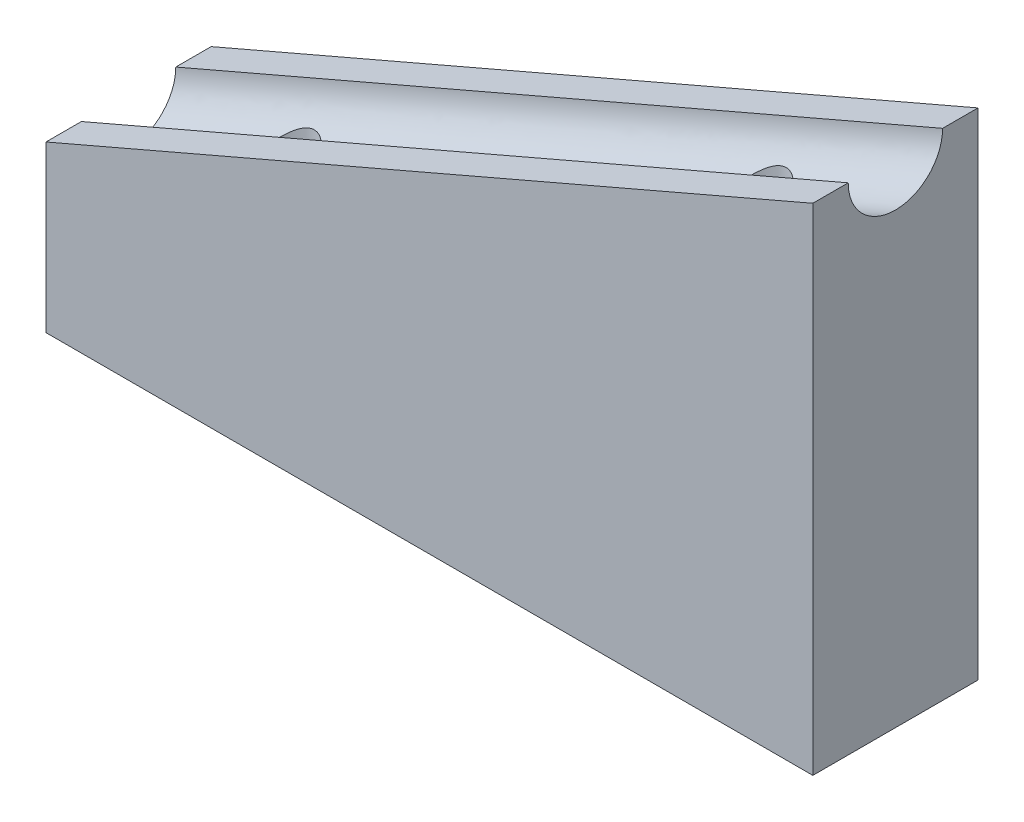
from build123d import *

# Parameters (mm, degrees)
SKETCH_1_W          = 32.5
SKETCH_1_H          = 7
EXTRUDE_1_DEPTH     = 21
CUT_EXTRUDE_1_REACH = 28.783
SKETCH_2_R          = 1.35
CUT_EXTRUDE_2_REACH = 29.46


with BuildPart() as part:
    # 草图1 → 凸台-拉伸1 (new body)
    with BuildSketch(Plane(origin=(0, 0, 0), x_dir=(1, 0, 0), z_dir=(0, 1, 0))):
        Rectangle(SKETCH_1_W, SKETCH_1_H)
    extrude(amount=EXTRUDE_1_DEPTH)

    # 草图2 → 切除-拉伸1 (cut, up to next)
    with BuildSketch(Plane.XZ, mode=Mode.PRIVATE) as cut_extrude_1_sk1:
        with Locations(Location((-10, 0, 0), (0, 0, 270))):
            Circle(SKETCH_2_R)
    cut_extrude_1_tool1 = extrude(cut_extrude_1_sk1.sketch, amount=-CUT_EXTRUDE_1_REACH, mode=Mode.PRIVATE) & part.part
    # 草图2 → 切除-拉伸1 (cut, up to next)
    with BuildSketch(Plane.XZ, mode=Mode.PRIVATE) as cut_extrude_1_sk2:
        with Locations(Location((10, 0, 0), (0, 0, 270))):
            Circle(SKETCH_2_R)
    cut_extrude_1_tool2 = extrude(cut_extrude_1_sk2.sketch, amount=-CUT_EXTRUDE_1_REACH, mode=Mode.PRIVATE) & part.part
    add(cut_extrude_1_tool1.solids().sort_by_distance((-10, 0, 0))[0], mode=Mode.SUBTRACT)
    add(cut_extrude_1_tool2.solids().sort_by_distance((10, 0, 0))[0], mode=Mode.SUBTRACT)

    # 草图3 → 切除-拉伸2 (cut, up to next)
    with BuildSketch(Plane.XY.offset(3.5), mode=Mode.PRIVATE) as cut_extrude_2_sk1:
        Polygon((-16.25, 21), (-16.25, 7), (16.25, 21), align=None)
    cut_extrude_2_tool1 = extrude(cut_extrude_2_sk1.sketch, amount=-CUT_EXTRUDE_2_REACH, mode=Mode.PRIVATE) & part.part
    add(cut_extrude_2_tool1.solids().sort_by_distance((-5.416667, 16.333333, 3.5))[0], mode=Mode.SUBTRACT)

    # 切除-扫描1: sweep along a path in 草图5
    with BuildLine(Plane(origin=(-5.086843681, 11.80874426, 0), x_dir=(0.9184126158110062, 0.3956238960416641, 0), z_dir=(-0.3956238960416641, 0.9184126158110062, 0))) as sweep_1_path:
        Line((-12.154837735, 0), (23.232306824, 0))
    # 草图4 → 切除-扫描1 (sweep, cut)
    with BuildSketch(Plane.ZY.offset(16.25)):
        with BuildLine():
            Line((-2, 7), (2, 7))
            ThreePointArc((2, 7), (0, 5), (-2, 7))
        make_face()
    sweep(path=sweep_1_path.line, mode=Mode.SUBTRACT)


solid = part.part
